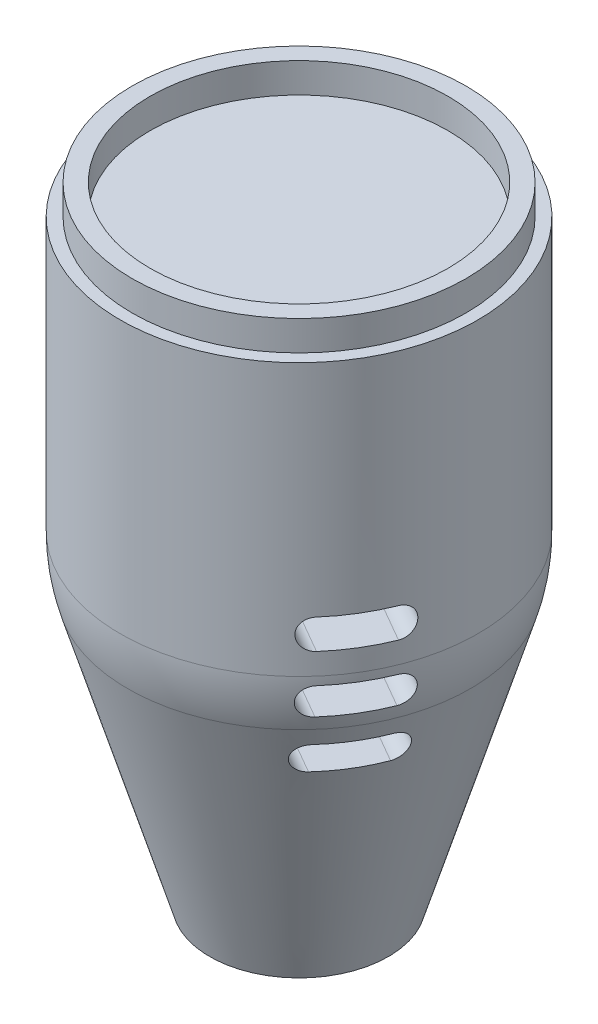
from build123d import *

# Parameters (mm, degrees)
SKETCH4_R                = 28
SKETCH4_R_2              = 25
EXTRUDE_THIN1_DEPTH      = 5
CUT_EXTRUDE1_DEPTH       = 114.247516529
LPATTERN1_COUNT          = 3
LPATTERN1_PITCH          = 10
CIRPATTERN7_COUNT        = 3
CIRPATTERN7_COPY_1_DEPTH = 114.247516529
CIRPATTERN7_COPY_2_DEPTH = 114.247516529
CIRPATTERN7_COPY_3_DEPTH = 114.247516529
CIRPATTERN7_COPY_4_DEPTH = 114.247516529


with BuildPart() as part:
    # Sketch3 → Revolve1 (revolve)
    with BuildSketch(Plane.XY, mode=Mode.PRIVATE) as revolve1_sk:
        with BuildLine():
            Line((0, 0), (0, 100))
            Line((0, 100), (30, 100))
            Line((30, 100), (30, 54.403065089))
            ThreePointArc((30, 54.403065089), (29.682011865, 50.046670749), (28.734788557, 45.782628522))
            Line((28.734788557, 45.782628522), (15, 0))
            Line((15, 0), (0, 0))
        make_face()
    revolve(revolve1_sk.sketch.rotate(Axis((0, 0, 0), (0, 1, 0)), 90), axis=Axis((0, 0, 0), (0, 1, 0)))

    # Sketch4 → Extrude-Thin1 (add)
    with BuildSketch(Plane(origin=(0, 100, 0), x_dir=(1, 0, 0), z_dir=(0, 1, 0))):
        Circle(SKETCH4_R)
        Circle(SKETCH4_R_2, mode=Mode.SUBTRACT)
    extrude(amount=EXTRUDE_THIN1_DEPTH)

    # Sketch9 → Cut-Extrude1 (cut, through all)
    with BuildSketch(Plane.XY):
        with BuildLine():
            Line((-4.256347382, 62.992288971), (5.743652618, 62.992288971))
            ThreePointArc((5.743652618, 62.992288971), (8.243652618, 60.492288971), (5.743652618, 57.992288971))
            Line((5.743652618, 57.992288971), (-4.256347382, 57.992288971))
            ThreePointArc((-4.256347382, 57.992288971), (-6.756347382, 60.492288971), (-4.256347382, 62.992288971))
        make_face()
    cut_extrude1 = extrude(amount=-CUT_EXTRUDE1_DEPTH, mode=Mode.SUBTRACT)

    # LPattern1: Cut-Extrude1 ×3
    with Locations(*[(0, -i * LPATTERN1_PITCH, 0) for i in range(1, LPATTERN1_COUNT)]):
        add(cut_extrude1, mode=Mode.SUBTRACT)

    # CirPattern7: Cut-Extrude1 ×3 about axis
    cirpattern7_axis = Axis((0, 0, 0), (0, -1, 0))
    for i in range(1, CIRPATTERN7_COUNT):
        add(cut_extrude1.rotate(cirpattern7_axis, i * 360 / CIRPATTERN7_COUNT), mode=Mode.SUBTRACT)

    # CirPattern7 copy 1 sketch → CirPattern7 copy 1 (cut, through all)
    with BuildSketch(Plane(origin=(0, -10, 0), x_dir=(-0.4999999999999998, 0, 0.8660254037844387), z_dir=(-0.8660254037844387, 0, -0.4999999999999998))):
        with BuildLine():
            Line((-4.256347382, 62.992288971), (5.743652618, 62.992288971))
            ThreePointArc((5.743652618, 62.992288971), (8.243652618, 60.492288971), (5.743652618, 57.992288971))
            Line((5.743652618, 57.992288971), (-4.256347382, 57.992288971))
            ThreePointArc((-4.256347382, 57.992288971), (-6.756347382, 60.492288971), (-4.256347382, 62.992288971))
        make_face()
    extrude(amount=-CIRPATTERN7_COPY_1_DEPTH, mode=Mode.SUBTRACT)

    # CirPattern7 copy 2 sketch → CirPattern7 copy 2 (cut, through all)
    with BuildSketch(Plane(origin=(0, -10, 0), x_dir=(-0.5000000000000004, 0, -0.8660254037844384), z_dir=(0.8660254037844384, 0, -0.5000000000000004))):
        with BuildLine():
            Line((-4.256347382, 62.992288971), (5.743652618, 62.992288971))
            ThreePointArc((5.743652618, 62.992288971), (8.243652618, 60.492288971), (5.743652618, 57.992288971))
            Line((5.743652618, 57.992288971), (-4.256347382, 57.992288971))
            ThreePointArc((-4.256347382, 57.992288971), (-6.756347382, 60.492288971), (-4.256347382, 62.992288971))
        make_face()
    extrude(amount=-CIRPATTERN7_COPY_2_DEPTH, mode=Mode.SUBTRACT)

    # CirPattern7 copy 3 sketch → CirPattern7 copy 3 (cut, through all)
    with BuildSketch(Plane(origin=(0, -20, 0), x_dir=(-0.4999999999999998, 0, 0.8660254037844387), z_dir=(-0.8660254037844387, 0, -0.4999999999999998))):
        with BuildLine():
            Line((-4.256347382, 62.992288971), (5.743652618, 62.992288971))
            ThreePointArc((5.743652618, 62.992288971), (8.243652618, 60.492288971), (5.743652618, 57.992288971))
            Line((5.743652618, 57.992288971), (-4.256347382, 57.992288971))
            ThreePointArc((-4.256347382, 57.992288971), (-6.756347382, 60.492288971), (-4.256347382, 62.992288971))
        make_face()
    extrude(amount=-CIRPATTERN7_COPY_3_DEPTH, mode=Mode.SUBTRACT)

    # CirPattern7 copy 4 sketch → CirPattern7 copy 4 (cut, through all)
    with BuildSketch(Plane(origin=(0, -20, 0), x_dir=(-0.5000000000000004, 0, -0.8660254037844384), z_dir=(0.8660254037844384, 0, -0.5000000000000004))):
        with BuildLine():
            Line((-4.256347382, 62.992288971), (5.743652618, 62.992288971))
            ThreePointArc((5.743652618, 62.992288971), (8.243652618, 60.492288971), (5.743652618, 57.992288971))
            Line((5.743652618, 57.992288971), (-4.256347382, 57.992288971))
            ThreePointArc((-4.256347382, 57.992288971), (-6.756347382, 60.492288971), (-4.256347382, 62.992288971))
        make_face()
    extrude(amount=-CIRPATTERN7_COPY_4_DEPTH, mode=Mode.SUBTRACT)


solid = part.part
